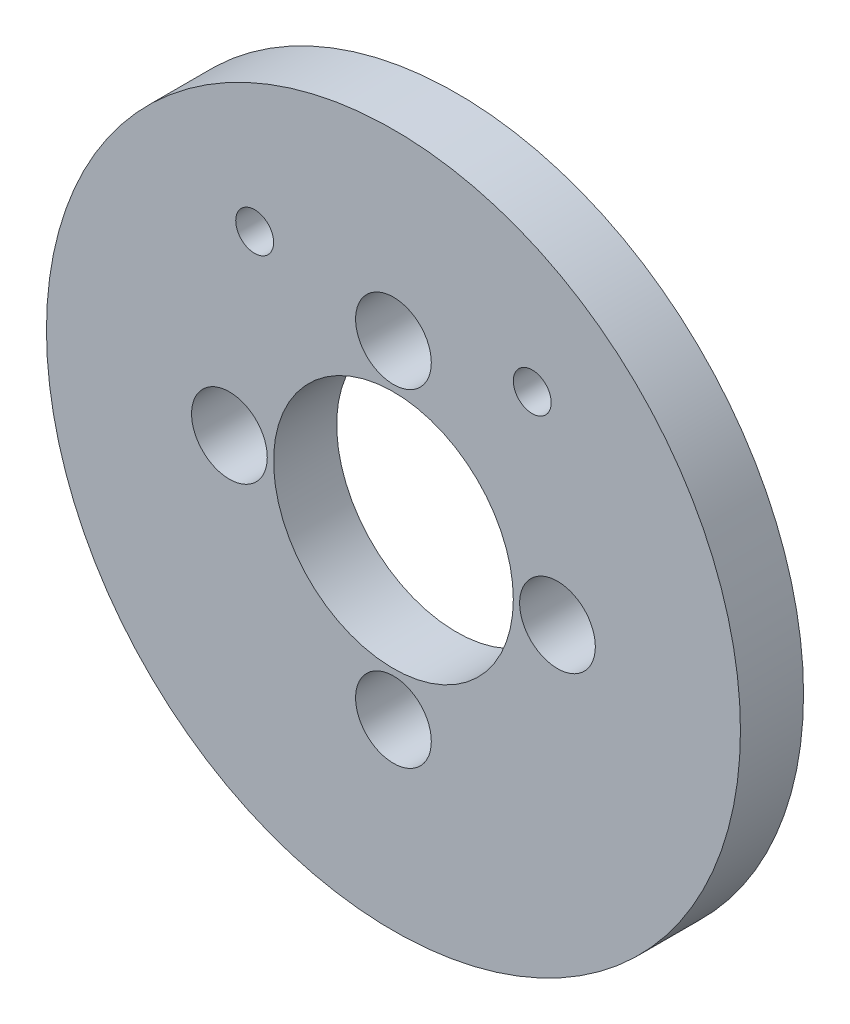
from build123d import *

# Parameters (mm, degrees)
ESQUISSE1_R             = 27.5
ESQUISSE1_R_2           = 9.5
BOSS_EXTRU_1_DEPTH      = 5
ESQUISSE2_R             = 3
ESQUISSE2_R_2           = 1.5
ENL_V_MAT_EXTRU_1_DEPTH = 5


with BuildPart() as part:
    # Esquisse1 → Boss.-Extru.1 (new body)
    with BuildSketch(Plane.XY):
        Circle(ESQUISSE1_R)
        Circle(ESQUISSE1_R_2, mode=Mode.SUBTRACT)
    extrude(amount=BOSS_EXTRU_1_DEPTH)

    # Esquisse2 → Enlèv. mat.-Extru.1 (cut)
    with BuildSketch(Plane.XY.offset(5)):
        with Locations((-13, 0)):
            Circle(ESQUISSE2_R)
        with Locations((0, 13)):
            Circle(ESQUISSE2_R)
        with Locations((13, 0)):
            Circle(ESQUISSE2_R)
        with Locations((0, -13)):
            Circle(ESQUISSE2_R)
        with Locations((11, 15)):
            Circle(ESQUISSE2_R_2)
        with Locations(Location((-11, 15, 0), (0, 0, 180))):
            Circle(ESQUISSE2_R_2)
    extrude(amount=-ENL_V_MAT_EXTRU_1_DEPTH, mode=Mode.SUBTRACT)


solid = part.part
